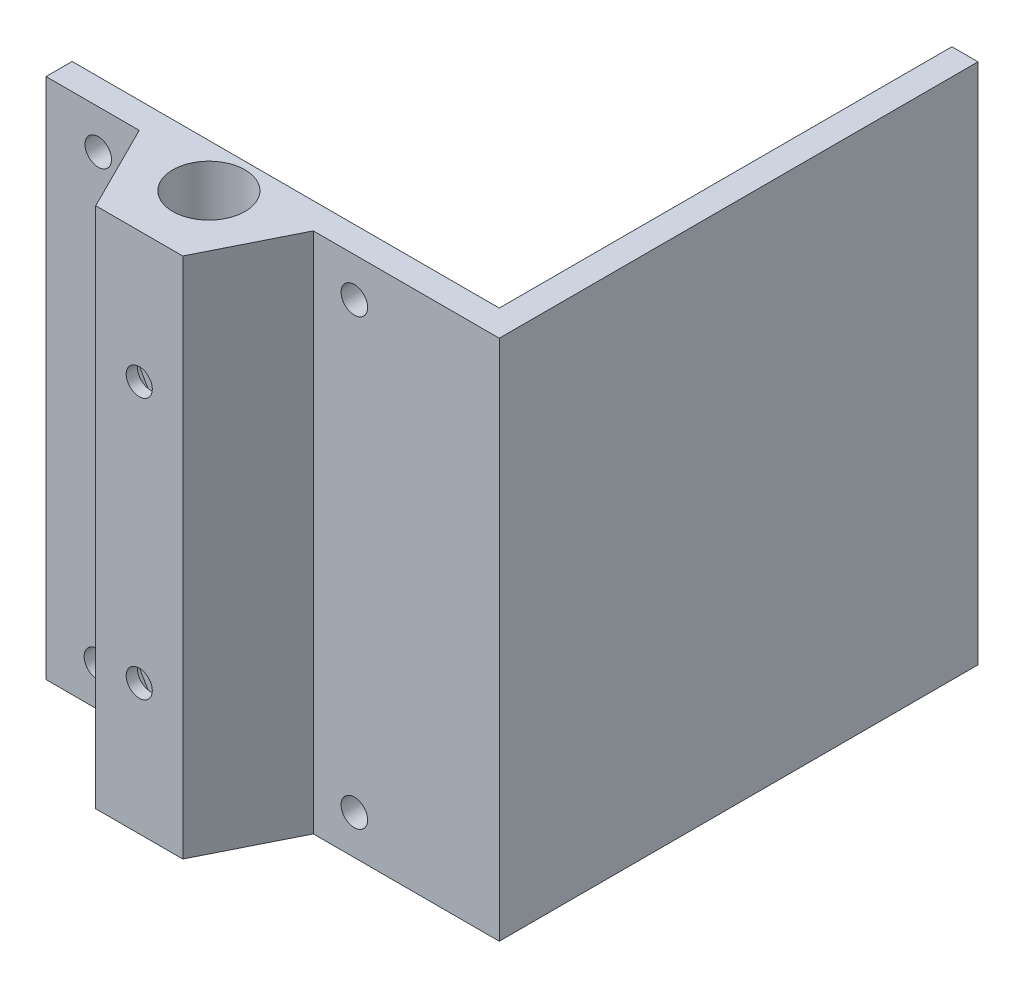
from build123d import *

# Parameters (mm, degrees)
SKETCH_1_W          = 45.073019954
SKETCH_1_H          = 60
SKETCH_1_R          = 1.525
EXTRUDE_1_DEPTH     = 3
SKETCH_2_W          = 10
SKETCH_2_H          = 60
EXTRUDE_2_DEPTH     = 10
HOLE_WIZARD_1_D     = 8.3
EXTRUDE_3_DEPTH     = 60
CUT_EXTRUDE_1_DEPTH = 0.7
HOLE_WIZARD_2_D     = 3
HOLE_WIZARD_2_DEPTH = 5
SKETCH_10_W         = 3
SKETCH_10_H         = 52
SKETCH_10_H_2       = 3
SKETCH_10_W_2       = 4
EXTRUDE_4_DEPTH     = 60


with BuildPart() as part:
    # 草图1 → 凸台-拉伸1 (new body)
    with BuildSketch(Plane.XY):
        with Locations((37.463490023, 30)):
            Rectangle(SKETCH_1_W, SKETCH_1_H)
        with Locations((20.831064203, 4.5)):
            Circle(SKETCH_1_R, mode=Mode.SUBTRACT)
        with Locations((50.351484989, 4.5)):
            Circle(SKETCH_1_R, mode=Mode.SUBTRACT)
        with Locations((20.926980046, 55.5)):
            Circle(SKETCH_1_R, mode=Mode.SUBTRACT)
        with Locations((50.351484989, 55.5)):
            Circle(SKETCH_1_R, mode=Mode.SUBTRACT)
    extrude(amount=EXTRUDE_1_DEPTH)

    # 草图2 → 凸台-拉伸2 (add)
    with BuildSketch(Plane.XY.offset(3)):
        with Locations((35.639232517, 30)):
            Rectangle(SKETCH_2_W, SKETCH_2_H)
    extrude(amount=EXTRUDE_2_DEPTH)

    # 孔1 (through all)
    with Locations(Plane(origin=(0, 0, 0), x_dir=(-1, 0, 0), z_dir=(0, -1, 0))):
        with Locations((-35.639232517, -5)):
            Hole(HOLE_WIZARD_1_D / 2)

    # 草图5 → 凸台-拉伸3 (add)
    with BuildSketch(Plane.XZ):
        Polygon((30.639232517, 13), (25.639232517, 3), (30.639232517, 3), align=None)
        Polygon((40.639232517, 13), (45.639232517, 3), (40.639232517, 3), align=None)
    extrude(amount=-EXTRUDE_3_DEPTH)

    # 草图7 → 切除-拉伸1 (cut, symmetric)
    with BuildSketch(Plane.XY.offset(11)):
        Polygon((37.313548298, 12.1), (38.987864079, 15), (37.313548298, 17.9), (33.964916737, 17.9), (32.290600956, 15), (33.964916737, 12.1), align=None)
        Polygon((38.987864079, 45), (37.313548298, 47.9), (33.964916737, 47.9), (32.290600956, 45), (33.964916737, 42.1), (37.313548298, 42.1), align=None)
    extrude(amount=CUT_EXTRUDE_1_DEPTH, both=True, mode=Mode.SUBTRACT)

    # 孔2
    with Locations(Plane.XY.offset(13)):
        with Locations((35.639232517, 45), (35.639232517, 15)):
            Hole(HOLE_WIZARD_2_D / 2, depth=HOLE_WIZARD_2_DEPTH)

    # 草图10 → 凸台-拉伸4 (add)
    with BuildSketch(Plane(origin=(0, 60, 0), x_dir=(1, 0, 0), z_dir=(0, 1, 0))):
        with Locations((65.5, 26)):
            Rectangle(SKETCH_10_W, SKETCH_10_H)
        with Locations((65.5, -1.5)):
            Rectangle(SKETCH_10_W, SKETCH_10_H_2)
        with Locations((62, -1.5)):
            Rectangle(SKETCH_10_W_2, SKETCH_10_H_2)
    extrude(amount=-EXTRUDE_4_DEPTH)


solid = part.part
